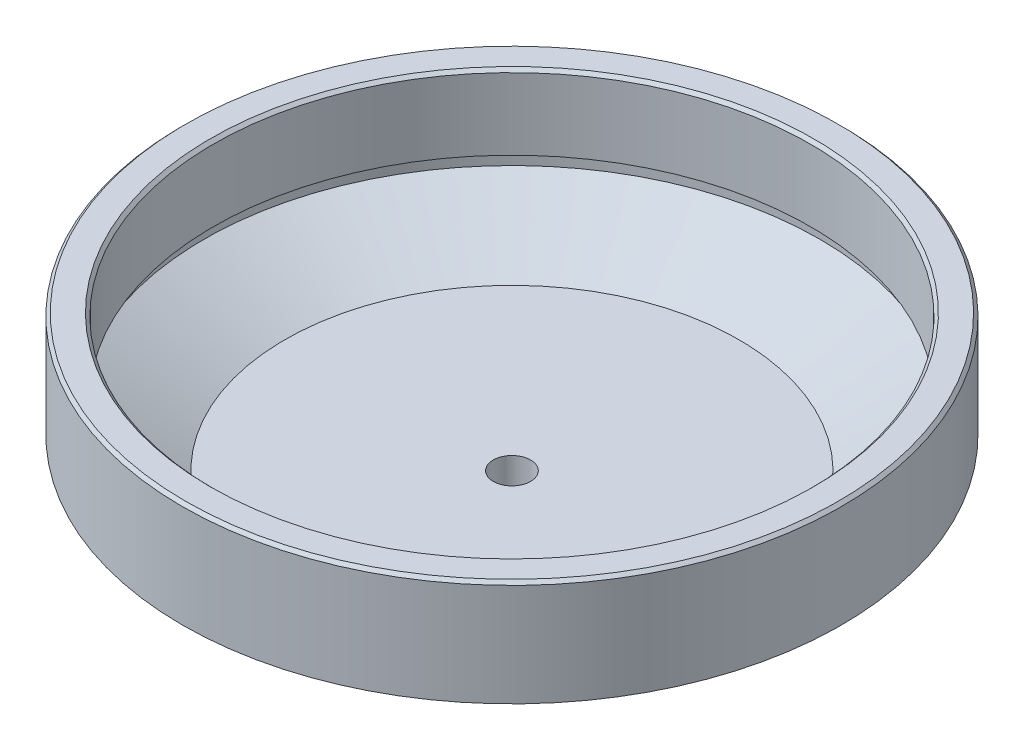
from build123d import *

# Parameters (mm, degrees)
CHAMFER_1_SIZE = 0.5


with BuildPart() as part:
    # Эскиз1 → Повернуть1 (revolve)
    with BuildSketch(Plane.XY):
        Polygon((-53, 28), (-53, 11), (-33.947441117, 0), (-3, 0), (-3, 6), (-36.509618943, 6), (-49.5, 13.5), (-49.5, 16), (-48, 16), (-48, 28), align=None)
    revolve(axis=Axis((0, 26.168985987, 0), (0, -1, 0)))

    # Фаска1
    chamfer_1_edges = [part.edges().sort_by_distance(p)[0] for p in [
        (3, 0, 0),
        (53, 28, 0),
        (48, 28, 0),
    ]]
    chamfer(chamfer_1_edges, length=CHAMFER_1_SIZE)


solid = part.part
